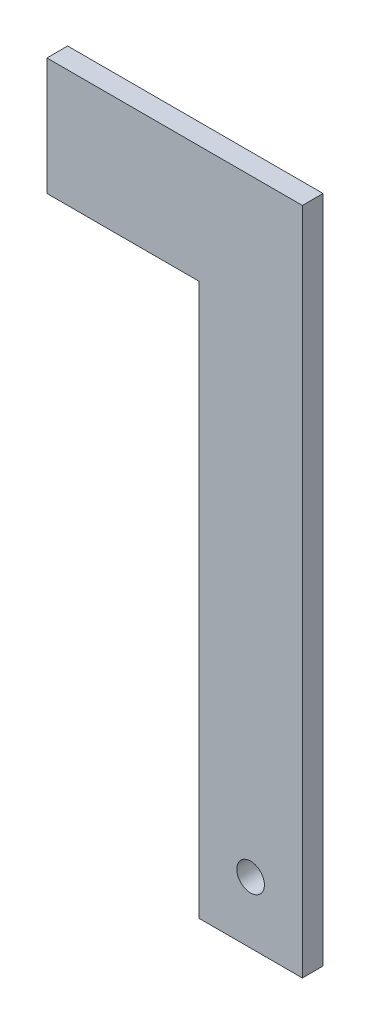
from build123d import *

# Parameters (mm, degrees)
CROQUIS1_R              = 2
SALIENTE_EXTRUIR1_DEPTH = 3


with BuildPart() as part:
    # Croquis1 → Saliente-Extruir1 (new body)
    with BuildSketch(Plane.XY):
        Polygon((20, -36.91496427), (20, 60), (3, 60), (-17, 60), (-17, 43), (5, 43), (5, -36.91496427), align=None)
        with Locations((12.5, -28)):
            Circle(CROQUIS1_R, mode=Mode.SUBTRACT)
    extrude(amount=SALIENTE_EXTRUIR1_DEPTH)


solid = part.part
